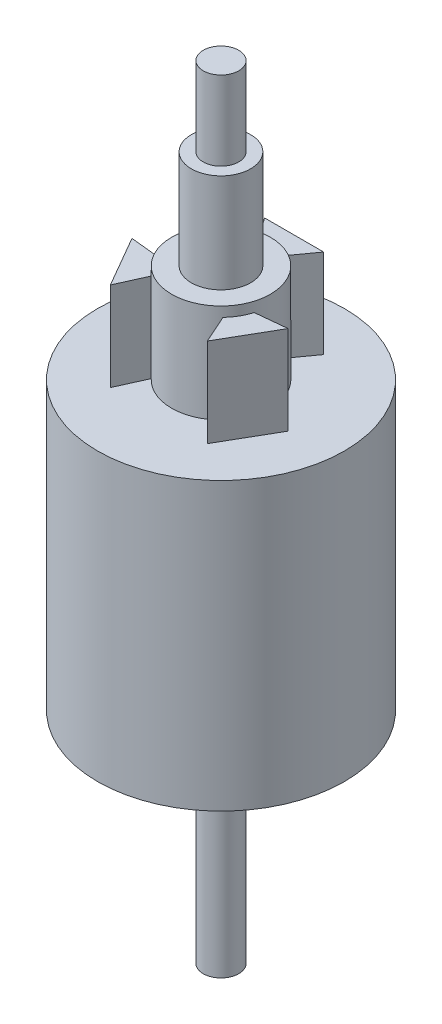
from build123d import *

# Parameters (mm, degrees)
SKETCH1_R           = 6.25
BOSS_EXTRUDE1_DEPTH = 14.5
SKETCH2_R           = 0.9
BOSS_EXTRUDE2_DEPTH = 11.1
SKETCH3_R           = 2.5
BOSS_EXTRUDE3_DEPTH = 5
SKETCH4_R           = 1.5
BOSS_EXTRUDE4_DEPTH = 5
BOSS_EXTRUDE5_START = 4
SKETCH5_R           = 0.9
BOSS_EXTRUDE5_DEPTH = 4
BOSS_EXTRUDE9_DEPTH = 4.5
CIRPATTERN1_COUNT   = 3


with BuildPart() as part:
    # Sketch1 → Boss-Extrude1 (new body)
    with BuildSketch(Plane(origin=(0, 0, 0), x_dir=(1, 0, 0), z_dir=(0, 1, 0))):
        with Locations(Location((0, 0, 0), (0, 0, 90))):
            Circle(SKETCH1_R)
    extrude(amount=BOSS_EXTRUDE1_DEPTH)

    # Sketch2 → Boss-Extrude2 (add)
    with BuildSketch(Plane(origin=(0, 0, 0), x_dir=(1, 0, 0), z_dir=(0, 1, 0))):
        with Locations(Location((0, 0, 0), (0, 0, 270))):
            Circle(SKETCH2_R)
    extrude(amount=-BOSS_EXTRUDE2_DEPTH)

    # Sketch3 → Boss-Extrude3 (add)
    with BuildSketch(Plane(origin=(0, 14.5, 0), x_dir=(1, 0, 0), z_dir=(0, 1, 0))):
        with Locations(Location((0, 0, 0), (0, 0, 270))):
            Circle(SKETCH3_R)
    extrude(amount=BOSS_EXTRUDE3_DEPTH)

    # Sketch4 → Boss-Extrude4 (add)
    with BuildSketch(Plane(origin=(0, 19.5, 0), x_dir=(1, 0, 0), z_dir=(0, 1, 0))):
        with Locations(Location((0, 0, 0), (0, 0, 270))):
            Circle(SKETCH4_R)
    extrude(amount=BOSS_EXTRUDE4_DEPTH)

    # Sketch5 → Boss-Extrude5 (add)
    with BuildSketch(Plane(origin=(0, 24.5, 0), x_dir=(1, 0, 0), z_dir=(0, 1, 0)).offset(BOSS_EXTRUDE5_START)):
        with Locations(Location((0, 0, 0), (0, 0, 270))):
            Circle(SKETCH5_R)
    extrude(amount=-BOSS_EXTRUDE5_DEPTH)

    # Sketch7 → Boss-Extrude9 (add)
    with BuildSketch(Plane(origin=(0, 14.5, 0), x_dir=(1, 0, 0), z_dir=(0, 1, 0))):
        with BuildLine():
            Line((-0.579481228, 2.431913137), (-1.495304536, 3.700729228))
            Line((-1.495304536, 3.700729228), (1.495304536, 3.700729228))
            Line((1.495304536, 3.700729228), (0.579481228, 2.431913137))
            ThreePointArc((0.579481228, 2.431913137), (0, 2.5), (-0.579481228, 2.431913137))
        make_face()
    boss_extrude9 = extrude(amount=BOSS_EXTRUDE9_DEPTH)

    # CirPattern1: Boss-Extrude9 ×3 about axis
    cirpattern1_axis = Axis((0, 0, 0), (0, 1, 0))
    for i in range(1, CIRPATTERN1_COUNT):
        add(boss_extrude9.rotate(cirpattern1_axis, i * 360 / CIRPATTERN1_COUNT))


solid = part.part
